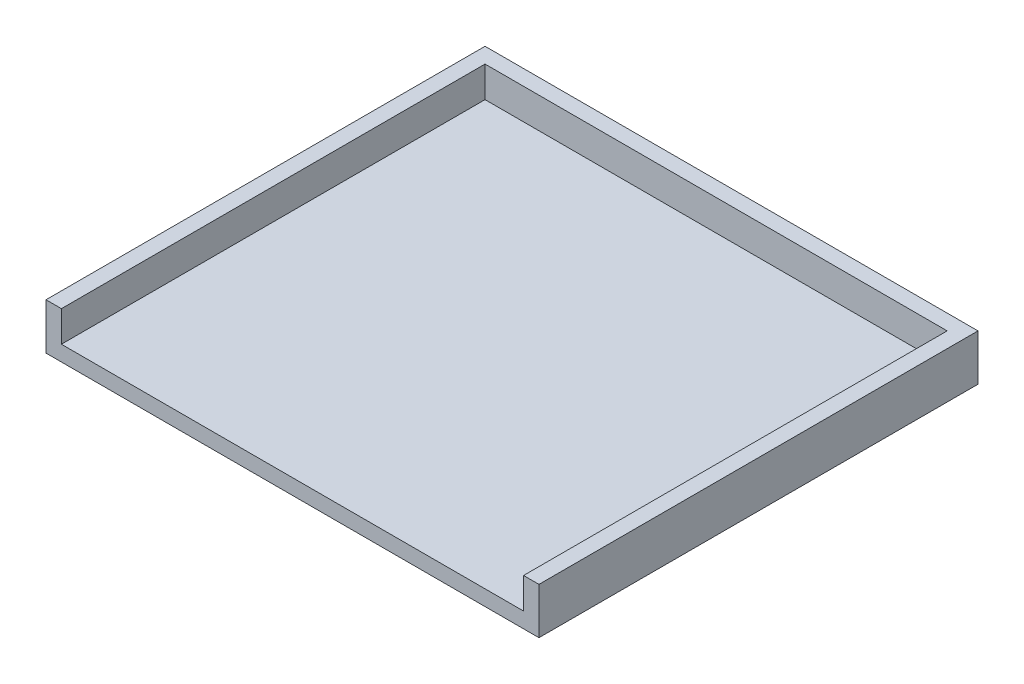
from build123d import *

# Parameters (mm, degrees)
SKETCH1_W           = 1280
SKETCH1_H           = 1140
BOSS_EXTRUDE1_DEPTH = 40
SKETCH2_W           = 40
SKETCH2_H           = 1140
BOSS_EXTRUDE2_DEPTH = 80
SKETCH3_W           = 1200
SKETCH3_H           = 40
BOSS_EXTRUDE3_DEPTH = 80


with BuildPart() as part:
    # Sketch1 → Boss-Extrude1 (new body)
    with BuildSketch(Plane(origin=(0, 0, 0), x_dir=(1, 0, 0), z_dir=(0, 1, 0))):
        with Locations((640, -570)):
            Rectangle(SKETCH1_W, SKETCH1_H)
    extrude(amount=BOSS_EXTRUDE1_DEPTH)

    # Sketch2 → Boss-Extrude2 (add)
    with BuildSketch(Plane(origin=(0, 40, 0), x_dir=(1, 0, 0), z_dir=(0, 1, 0))):
        with Locations((1260, -570)):
            Rectangle(SKETCH2_W, SKETCH2_H)
        with Locations((20, -570)):
            Rectangle(SKETCH2_W, SKETCH2_H)
    extrude(amount=BOSS_EXTRUDE2_DEPTH)

    # Sketch3 → Boss-Extrude3 (add)
    with BuildSketch(Plane(origin=(0, 40, 0), x_dir=(1, 0, 0), z_dir=(0, 1, 0))):
        with Locations((640, -20)):
            Rectangle(SKETCH3_W, SKETCH3_H)
    extrude(amount=BOSS_EXTRUDE3_DEPTH)


solid = part.part
